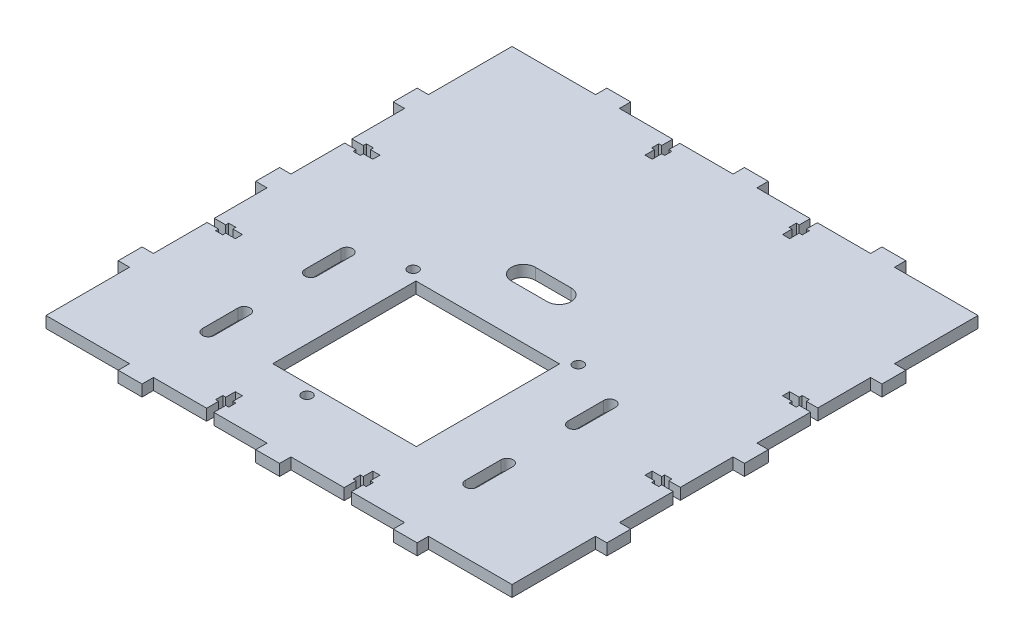
from build123d import *

# Parameters (mm, degrees)
SKETCH1_W           = 195.25
SKETCH1_H           = 195.25
BOSS_EXTRUDE1_DEPTH = 4.75
SKETCH2_W           = 10
SKETCH2_H           = 4.75
SKETCH2_W_2         = 4.75
SKETCH2_H_2         = 10
BOSS_EXTRUDE2_DEPTH = 4.75
SKETCH3_W           = 3
SKETCH3_H           = 12
SKETCH3_W_2         = 5.5
SKETCH3_H_2         = 3
CUT_EXTRUDE1_DEPTH  = 4.75
CIRPATTERN1_COUNT   = 4
SKETCH4_R           = 2.15
SKETCH4_W           = 60.17
SKETCH4_H           = 60.01
CUT_EXTRUDE2_DEPTH  = 283.882594905


with BuildPart() as part:
    # Sketch1 → Boss-Extrude1 (new body)
    with BuildSketch(Plane(origin=(0, 0, 0), x_dir=(1, 0, 0), z_dir=(0, 1, 0))):
        with Locations((-97.625, 97.625)):
            Rectangle(SKETCH1_W, SKETCH1_H)
    extrude(amount=BOSS_EXTRUDE1_DEPTH)

    # Sketch2 → Boss-Extrude2 (add)
    with BuildSketch(Plane(origin=(0, 4.75, 0), x_dir=(1, 0, 0), z_dir=(0, 1, 0))):
        with Locations((-155.25, 197.625)):
            Rectangle(SKETCH2_W, SKETCH2_H)
        with Locations((-97.625, 197.625)):
            Rectangle(SKETCH2_W, SKETCH2_H)
        with Locations((-40, 197.625)):
            Rectangle(SKETCH2_W, SKETCH2_H)
        with Locations((2.375, 155.25)):
            Rectangle(SKETCH2_W_2, SKETCH2_H_2)
        with Locations((2.375, 97.625)):
            Rectangle(SKETCH2_W_2, SKETCH2_H_2)
        with Locations((2.375, 40)):
            Rectangle(SKETCH2_W_2, SKETCH2_H_2)
        with Locations((-40, -2.375)):
            Rectangle(SKETCH2_W, SKETCH2_H)
        with Locations((-97.625, -2.375)):
            Rectangle(SKETCH2_W, SKETCH2_H)
        with Locations((-155.25, -2.375)):
            Rectangle(SKETCH2_W, SKETCH2_H)
        with Locations((-197.625, 40)):
            Rectangle(SKETCH2_W_2, SKETCH2_H_2)
        with Locations((-197.625, 97.625)):
            Rectangle(SKETCH2_W_2, SKETCH2_H_2)
        with Locations((-197.625, 155.25)):
            Rectangle(SKETCH2_W_2, SKETCH2_H_2)
    extrude(amount=-BOSS_EXTRUDE2_DEPTH)

    # Sketch3 → Cut-Extrude1 (cut)
    with BuildSketch(Plane(origin=(0, 4.75, 0), x_dir=(1, 0, 0), z_dir=(0, 1, 0))):
        with Locations((-126.4375, 6)):
            Rectangle(SKETCH3_W, SKETCH3_H)
        with Locations((-126.4375, 6.5)):
            Rectangle(SKETCH3_W_2, SKETCH3_H_2)
        with Locations((-68.8125, 6)):
            Rectangle(SKETCH3_W, SKETCH3_H)
        with Locations((-68.8125, 6.5)):
            Rectangle(SKETCH3_W_2, SKETCH3_H_2)
    cut_extrude1 = extrude(amount=-CUT_EXTRUDE1_DEPTH, mode=Mode.SUBTRACT)

    # CirPattern1: Cut-Extrude1 ×4 about axis
    cirpattern1_axis = Axis((-97.625, 0, -97.831288278), (0, 1, 0))
    for i in range(1, CIRPATTERN1_COUNT):
        add(cut_extrude1.rotate(cirpattern1_axis, i * 360 / CIRPATTERN1_COUNT), mode=Mode.SUBTRACT)

    # Sketch4 → Cut-Extrude2 (cut, through all)
    with BuildSketch(Plane(origin=(0, 4.75, 0), x_dir=(1, 0, 0), z_dir=(0, 1, 0))):
        with Locations(Location((-111.595, 25.715, 0), (0, 0, 270))):
            Circle(SKETCH4_R)
        with Locations(Location((-65.875, 93.66, 0), (0, 0, 270))):
            Circle(SKETCH4_R)
        with Locations(Location((-135.09, 93.66, 0), (0, 0, 270))):
            Circle(SKETCH4_R)
        with Locations((-100.165, 60.005)):
            Rectangle(SKETCH4_W, SKETCH4_H)
        with BuildLine():
            Line((-152.75, 43), (-152.75, 28))
            ThreePointArc((-152.75, 28), (-155.25, 25.5), (-157.75, 28))
            Line((-157.75, 28), (-157.75, 43))
            ThreePointArc((-157.75, 43), (-155.25, 45.5), (-152.75, 43))
        make_face()
        with BuildLine():
            Line((-42.58, 43), (-42.58, 28))
            ThreePointArc((-42.58, 28), (-45.08, 25.5), (-47.58, 28))
            Line((-47.58, 28), (-47.58, 43))
            ThreePointArc((-47.58, 43), (-45.08, 45.5), (-42.58, 43))
        make_face()
        with BuildLine():
            Line((-42.58, 86.01), (-42.58, 71.01))
            ThreePointArc((-42.58, 71.01), (-45.08, 68.51), (-47.58, 71.01))
            Line((-47.58, 71.01), (-47.58, 86.01))
            ThreePointArc((-47.58, 86.01), (-45.08, 88.51), (-42.58, 86.01))
        make_face()
        with BuildLine():
            Line((-110.25, 120.01), (-95.25, 120.01))
            ThreePointArc((-95.25, 120.01), (-90.25, 115.01), (-95.25, 110.01))
            Line((-95.25, 110.01), (-110.25, 110.01))
            ThreePointArc((-110.25, 110.01), (-115.25, 115.01), (-110.25, 120.01))
        make_face()
        with BuildLine():
            Line((-152.75, 86.01), (-152.75, 71.01))
            ThreePointArc((-152.75, 71.01), (-155.25, 68.51), (-157.75, 71.01))
            Line((-157.75, 71.01), (-157.75, 86.01))
            ThreePointArc((-157.75, 86.01), (-155.25, 88.51), (-152.75, 86.01))
        make_face()
    extrude(amount=-CUT_EXTRUDE2_DEPTH, mode=Mode.SUBTRACT)


solid = part.part
